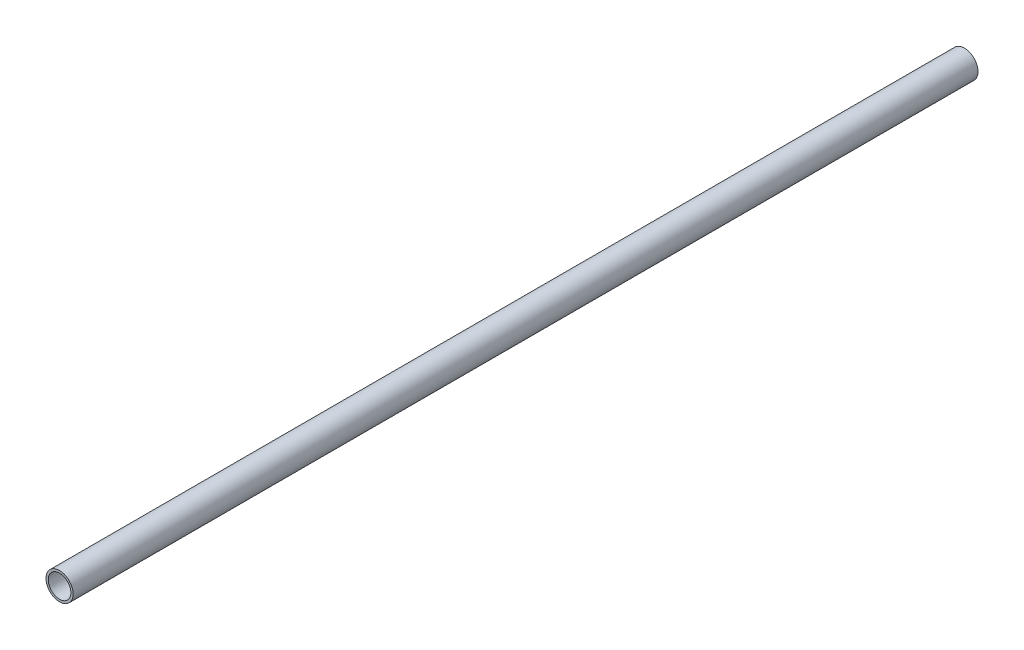
from build123d import *

# Parameters (mm, degrees)
ESQUISSE1_R        = 3
ESQUISSE1_R_2      = 2.5
BOSS_EXTRU_1_DEPTH = 200


with BuildPart() as part:
    # Esquisse1 → Boss.-Extru.1 (new body)
    with BuildSketch(Plane.XY):
        Circle(ESQUISSE1_R)
        Circle(ESQUISSE1_R_2, mode=Mode.SUBTRACT)
    extrude(amount=BOSS_EXTRU_1_DEPTH)


solid = part.part
